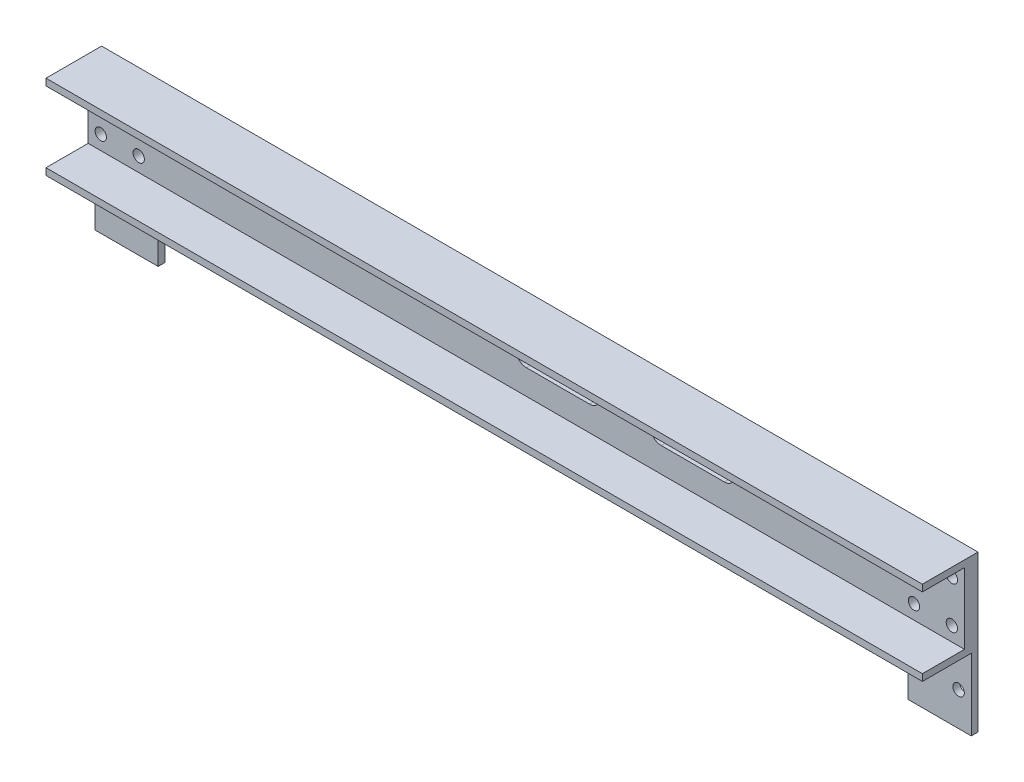
from build123d import *

# Parameters (mm, degrees)
BOSS_EXTRUDE1_DEPTH     = 8
SKETCH2_W               = 1040
SKETCH2_H               = 100
BOSS_EXTRUDE2_DEPTH     = 8
CUT_EXTRUDE1_DEPTH      = 538.476511115
CUT_EXTRUDE1_DEPTH_BACK = 538.476511115
SKETCH4_W               = 1040
SKETCH4_H               = 8
BOSS_EXTRUDE3_DEPTH     = 50
F_12_0MM_DOWEL_HOLE1_D  = 13.5


with BuildPart() as part:
    # Sketch1 → Boss-Extrude1 (new body)
    with BuildSketch(Plane.XY):
        Polygon((-445, -50), (445, -50), (445, -135), (520, -135), (520, -50), (520, 50), (-520, 50), (-520, -50), (-520, -135), (-445, -135), align=None)
    extrude(amount=BOSS_EXTRUDE1_DEPTH)

    # Sketch2 → Boss-Extrude2 (add)
    with BuildSketch(Plane.XY.offset(8)):
        Rectangle(SKETCH2_W, SKETCH2_H)
    extrude(amount=BOSS_EXTRUDE2_DEPTH)

    # Sketch3 → Cut-Extrude1 (cut, two sides: drawn at the far end of the back side and taken through both)
    with BuildSketch(Plane.XY.offset(16).offset(-CUT_EXTRUDE1_DEPTH_BACK)):
        with BuildLine():
            Line((0, 12.5), (75, 12.5))
            ThreePointArc((75, 12.5), (87.5, 0), (75, -12.5))
            Line((75, -12.5), (0, -12.5))
            ThreePointArc((0, -12.5), (-12.5, 0), (0, 12.5))
        make_face()
        with BuildLine():
            Line((160, 12.5), (235, 12.5))
            ThreePointArc((235, 12.5), (247.5, 0), (235, -12.5))
            Line((235, -12.5), (160, -12.5))
            ThreePointArc((160, -12.5), (147.5, 0), (160, 12.5))
        make_face()
    extrude(amount=CUT_EXTRUDE1_DEPTH + CUT_EXTRUDE1_DEPTH_BACK, mode=Mode.SUBTRACT)

    # Sketch4 → Boss-Extrude3 (add)
    with BuildSketch(Plane.XY.offset(16)):
        with Locations((0, 46)):
            Rectangle(SKETCH4_W, SKETCH4_H)
        with Locations((0, -46)):
            Rectangle(SKETCH4_W, SKETCH4_H)
    extrude(amount=BOSS_EXTRUDE3_DEPTH)

    # Ø12.0mm Dowel Hole1 (through all)
    with Locations(Plane.XY.offset(16)):
        with Locations((-460, 25), (-505, 25), (-505, -25), (-460, -25), (-460, -95), (-505, -95), (460, -95), (505, -95), (505, -25), (460, -25), (460, 25), (505, 25)):
            Hole(F_12_0MM_DOWEL_HOLE1_D / 2)


solid = part.part
